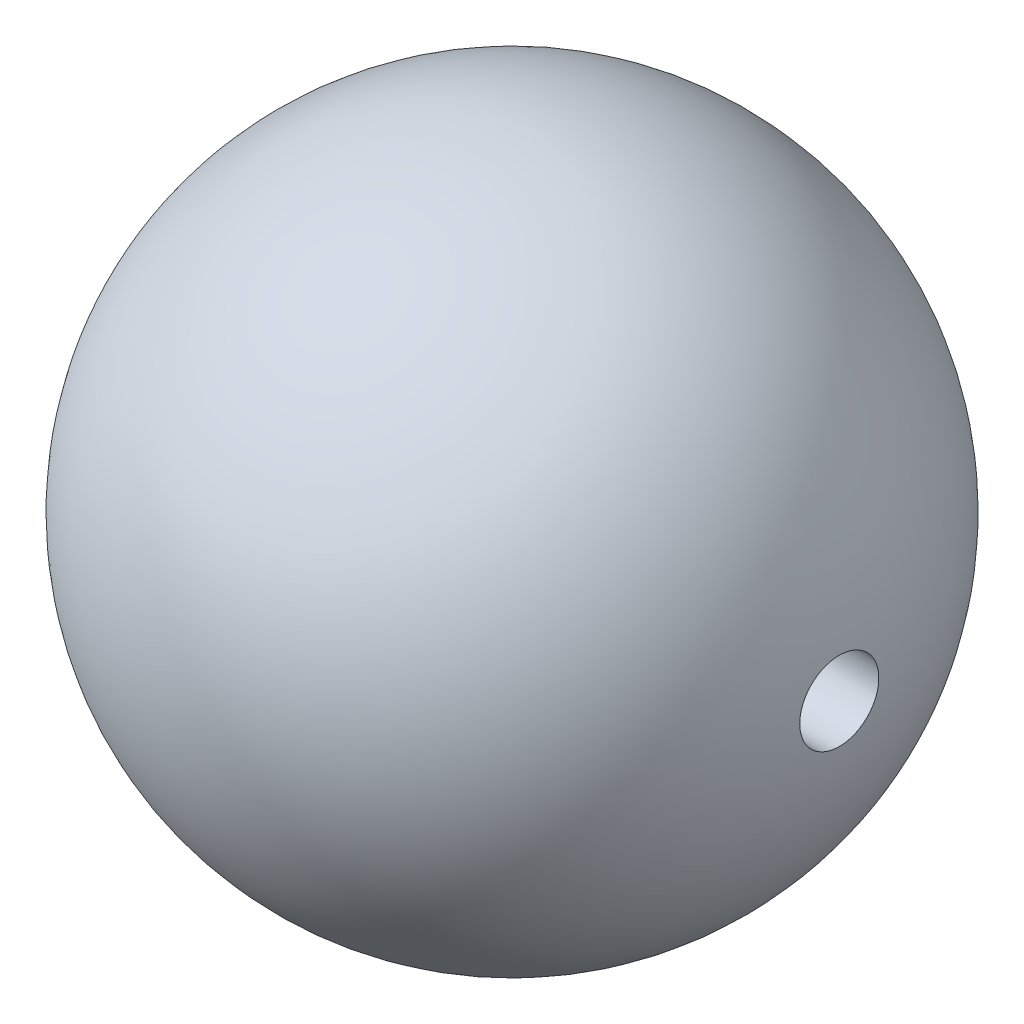
from build123d import *

# Parameters (mm, degrees)
CUT_EXTRUDE1_DEPTH      = 22.650635095
CUT_EXTRUDE1_DEPTH_BACK = 22.650635095
SKETCH3_R               = 1.5


with BuildPart() as part:
    # Sketch2 → Revolve1 (revolve)
    with BuildSketch(Plane.XY):
        with BuildLine():
            Line((0, 12.5), (0, -12.5))
            ThreePointArc((0, -12.5), (12.5, 0), (0, 12.5))
        make_face()
    revolve(axis=Axis((0, 12.5, 0), (0, -1, 0)))

    # Sketch3 → Cut-Extrude1 (cut, two sides: drawn at the far end of the back side and taken through both)
    with BuildSketch(Plane(origin=(0, 0, 0), x_dir=(0, 0, -1), z_dir=(1, 0, 0)).offset(-CUT_EXTRUDE1_DEPTH_BACK)):
        with Locations(Location((0, 0, 0), (0, 0, 180))):
            Circle(SKETCH3_R)
    extrude(amount=CUT_EXTRUDE1_DEPTH + CUT_EXTRUDE1_DEPTH_BACK, mode=Mode.SUBTRACT)


solid = part.part
